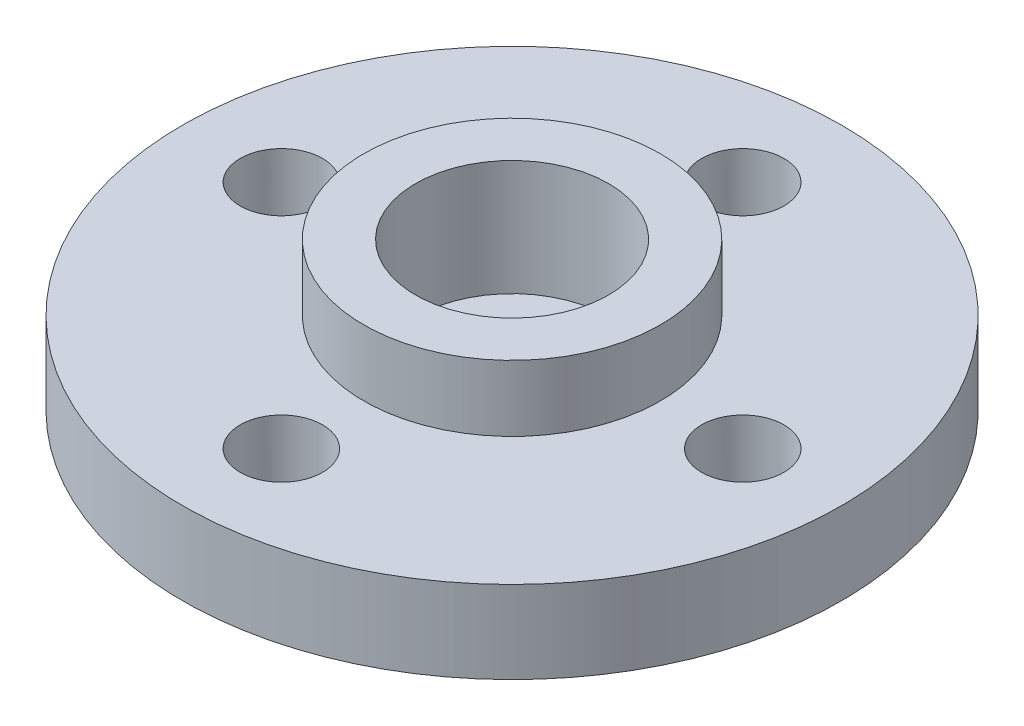
from build123d import *

# Parameters (mm, degrees)
M3_TAPPED_HOLE1_D = 2.5
CIRPATTERN1_COUNT = 4


with BuildPart() as part:
    # Sketch1 → Revolve1 (revolve)
    with BuildSketch(Plane(origin=(0, 0, 0), x_dir=(0, 0, -1), z_dir=(1, 0, 0))):
        Polygon((1.6, 0), (1.6, 1), (2.93, 1), (2.93, 4.5), (4.5, 4.5), (4.5, 2.5), (10, 2.5), (10, 0), align=None)
    revolve(axis=Axis((0, 0, 0), (0, 1, 0)))

    # M3 Tapped Hole1 (through all)
    with Locations(Plane(origin=(0, 0, 0), x_dir=(-1, 0, 0), z_dir=(0, -1, 0))):
        with Locations((0, -7)):
            m3_tapped_hole1 = Hole(M3_TAPPED_HOLE1_D / 2)

    # CirPattern1: M3 Tapped Hole1 ×4 about axis
    cirpattern1_axis = Axis((0, 0, 0), (0, 1, 0))
    for i in range(1, CIRPATTERN1_COUNT):
        add(m3_tapped_hole1.rotate(cirpattern1_axis, i * 360 / CIRPATTERN1_COUNT), mode=Mode.SUBTRACT)


solid = part.part
